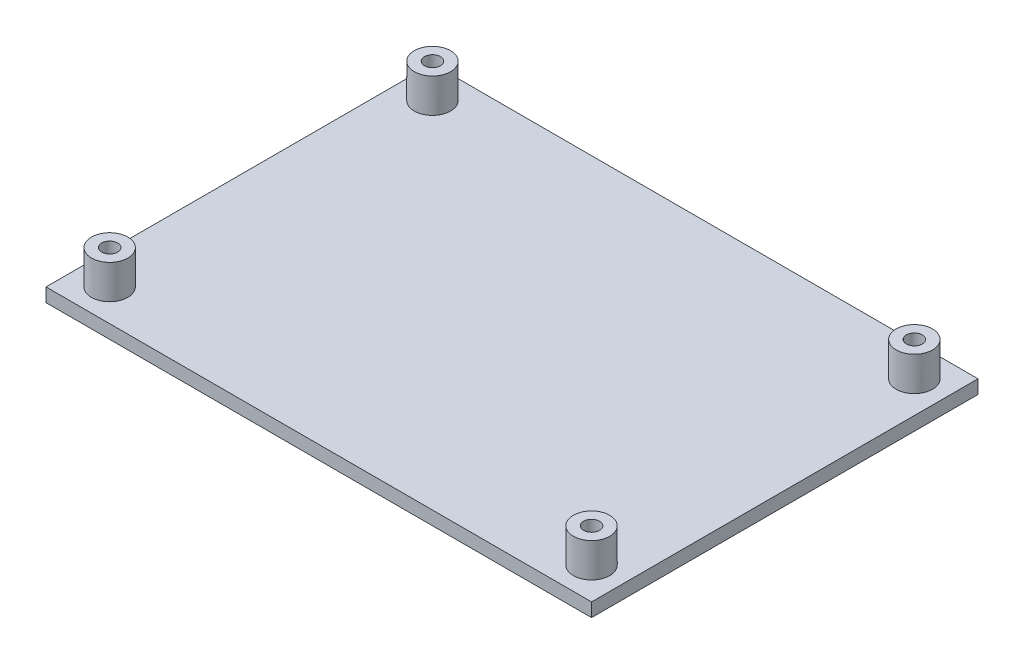
from build123d import *

# Parameters (mm, degrees)
SKETCH1_W           = 120
SKETCH1_H           = 85
BOSS_EXTRUDE1_DEPTH = 3
SKETCH2_R           = 4
SKETCH2_R_2         = 1.75
BOSS_EXTRUDE2_DEPTH = 7.5


with BuildPart() as part:
    # Sketch1 → Boss-Extrude1 (new body)
    with BuildSketch(Plane(origin=(0, 0, 0), x_dir=(1, 0, 0), z_dir=(0, 1, 0))):
        with Locations((60, 42.5)):
            Rectangle(SKETCH1_W, SKETCH1_H)
    extrude(amount=BOSS_EXTRUDE1_DEPTH)

    # Sketch2 → Boss-Extrude2 (add)
    # profile 1 of 4: a face of its own
    with BuildSketch(Plane(origin=(0, 3, 0), x_dir=(1, 0, 0), z_dir=(0, 1, 0))):
        with Locations(Location((7, 78, 0), (0, 0, 90))):
            Circle(SKETCH2_R)
        with Locations(Location((7, 78, 0), (0, 0, 270))):
            Circle(SKETCH2_R_2, mode=Mode.SUBTRACT)
    # profile 2 of 4: a face of its own
    with BuildSketch(Plane(origin=(0, 3, 0), x_dir=(1, 0, 0), z_dir=(0, 1, 0))):
        with Locations(Location((7, 7, 0), (0, 0, 90))):
            Circle(SKETCH2_R)
        with Locations(Location((7, 7, 0), (0, 0, 270))):
            Circle(SKETCH2_R_2, mode=Mode.SUBTRACT)
    # profile 3 of 4: a face of its own
    with BuildSketch(Plane(origin=(0, 3, 0), x_dir=(1, 0, 0), z_dir=(0, 1, 0))):
        with Locations(Location((113, 7, 0), (0, 0, 90))):
            Circle(SKETCH2_R)
        with Locations(Location((113, 7, 0), (0, 0, 270))):
            Circle(SKETCH2_R_2, mode=Mode.SUBTRACT)
    # profile 4 of 4: a face of its own
    with BuildSketch(Plane(origin=(0, 3, 0), x_dir=(1, 0, 0), z_dir=(0, 1, 0))):
        with Locations(Location((113, 78, 0), (0, 0, 90))):
            Circle(SKETCH2_R)
        with Locations(Location((113, 78, 0), (0, 0, 270))):
            Circle(SKETCH2_R_2, mode=Mode.SUBTRACT)
    extrude(amount=BOSS_EXTRUDE2_DEPTH)


solid = part.part
